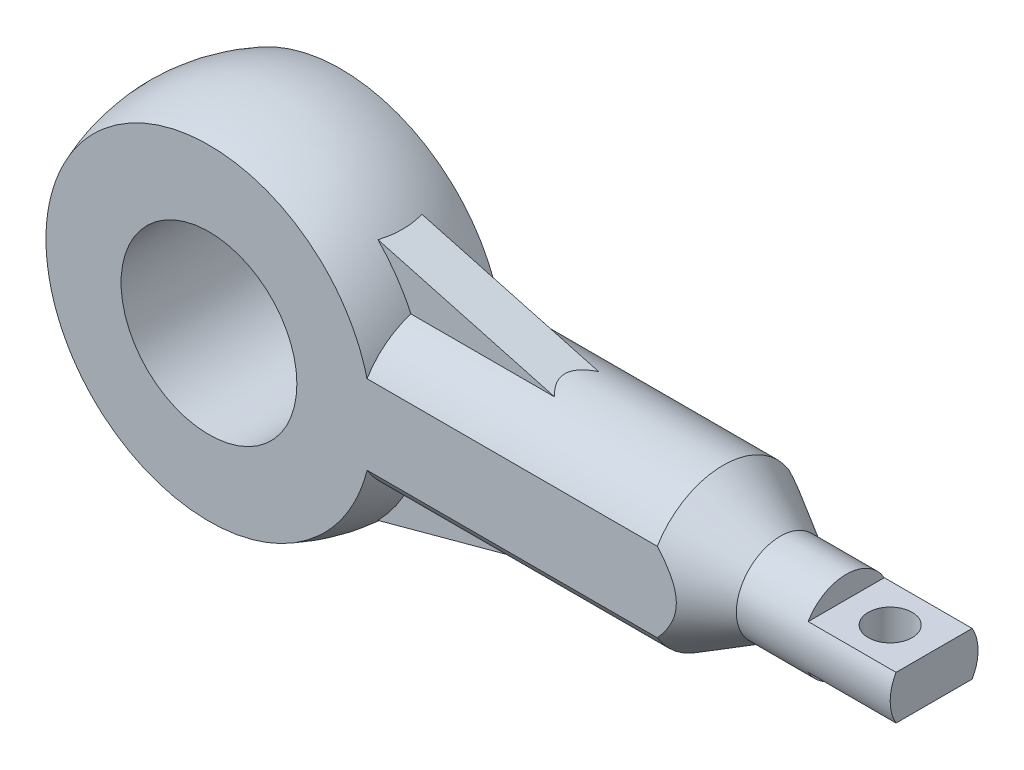
from build123d import *

# Parameters (mm, degrees)
CUT_EXTRUDE_START                    = 15
SKETCH_4_W                           = 227.596726831
SKETCH_4_H                           = 99.432892292
CUT_EXTRUDE_1_DEPTH                  = 50
CUT_EXTRUDE_2_REACH                  = 160.114
SKETCH_5_R                           = 20
CUT_EXTRUDE_4_REACH                  = 157.965
CUT_EXTRUDE_4_END_RADIUS             = 10
SKETCH_6_W                           = 20
SKETCH_6_H                           = 5
CUT_EXTRUDE_4_DIRECTION_2_REACH      = 157.965
CUT_EXTRUDE_4_DIRECTION_2_END_RADIUS = 10
CUT_EXTRUDE_5_REACH                  = 159.321
SKETCH_8_R                           = 5
RIB_1_REACH                          = 157.965
SKETCH_9_WALL_W                      = 352.18110561
SKETCH_9_WALL_H                      = 10


with BuildPart() as part:
    # 草图2 → 旋转1 (revolve)
    with BuildSketch(Plane.XY, mode=Mode.PRIVATE) as revolve_1_sk:
        with BuildLine():
            Line((35.968736425, 17.5), (102.009618943, 17.5))
            Line((102.009618943, 17.5), (115, 10))
            Line((115, 10), (150, 10))
            Line((150, 10), (150, 0))
            Line((150, 0), (40, 0))
            Line((40, 0), (-40, 0))
            ThreePointArc((-40, 0), (-8.979157617, 38.979157617), (35.968736425, 17.5))
        make_face()
    revolve(revolve_1_sk.sketch.rotate(Axis((0, 0, 0), (1, 0, 0)), 90), axis=Axis((0, 0, 0), (1, 0, 0)))

    # 草图4 → 切除-拉伸1 (cut)
    with BuildSketch(Plane.XY.offset(CUT_EXTRUDE_START)):
        with Locations((54.933799673, 2.64801311)):
            Rectangle(SKETCH_4_W, SKETCH_4_H)
    cut_extrude_1 = extrude(amount=CUT_EXTRUDE_1_DEPTH, mode=Mode.SUBTRACT)

    # 镜向1: 切除-拉伸1 across plane
    add(cut_extrude_1.mirror(Plane.XY), mode=Mode.SUBTRACT)

    # 草图5 → 切除-拉伸2 (cut, up to next)
    with BuildSketch(Plane.XY.offset(15), mode=Mode.PRIVATE) as cut_extrude_2_sk1:
        Circle(SKETCH_5_R)
    cut_extrude_2_tool1 = extrude(cut_extrude_2_sk1.sketch, amount=-CUT_EXTRUDE_2_REACH, mode=Mode.PRIVATE) & part.part
    add(cut_extrude_2_tool1.solids().sort_by_distance((0, 0, 15))[0], mode=Mode.SUBTRACT)

    # 切除-拉伸4: up to this cylinder (the profile starts inside it)
    cut_extrude_4_end = Plane(origin=(140, 0, 0), z_dir=(-1, 0, 0)) * Cylinder(CUT_EXTRUDE_4_END_RADIUS, 336.93, mode=Mode.PRIVATE)
    # 草图6 → 切除-拉伸4 (cut, up to the surface)
    with BuildSketch(Plane.XY, mode=Mode.PRIVATE) as cut_extrude_4_sk1:
        with Locations((140, 7.5)):
            Rectangle(SKETCH_6_W, SKETCH_6_H)
    cut_extrude_4_tool1 = extrude(cut_extrude_4_sk1.sketch, amount=-CUT_EXTRUDE_4_REACH, mode=Mode.PRIVATE) & cut_extrude_4_end
    add(cut_extrude_4_tool1.solids().sort_by_distance((140, 7.5, 0))[0], mode=Mode.SUBTRACT)
    # 草图6 → 切除-拉伸4 (cut, up to the surface)
    with BuildSketch(Plane.XY, mode=Mode.PRIVATE) as cut_extrude_4_sk2:
        with Locations((140, -7.5)):
            Rectangle(SKETCH_6_W, SKETCH_6_H)
    cut_extrude_4_tool2 = extrude(cut_extrude_4_sk2.sketch, amount=-CUT_EXTRUDE_4_REACH, mode=Mode.PRIVATE) & cut_extrude_4_end
    add(cut_extrude_4_tool2.solids().sort_by_distance((140, -7.5, 0))[0], mode=Mode.SUBTRACT)

    # 切除-拉伸4 direction 2: up to this cylinder (the profile starts inside it)
    cut_extrude_4_direction_2_end = Plane(origin=(140, 0, 0), z_dir=(-1, 0, 0)) * Cylinder(CUT_EXTRUDE_4_DIRECTION_2_END_RADIUS, 336.93, mode=Mode.PRIVATE)
    # 草图6 → 切除-拉伸4 direction 2 (cut, up to the surface)
    with BuildSketch(Plane.XY, mode=Mode.PRIVATE) as cut_extrude_4_direction_2_sk1:
        with Locations((140, 7.5)):
            Rectangle(SKETCH_6_W, SKETCH_6_H)
    cut_extrude_4_direction_2_tool1 = extrude(cut_extrude_4_direction_2_sk1.sketch, amount=CUT_EXTRUDE_4_DIRECTION_2_REACH, mode=Mode.PRIVATE) & cut_extrude_4_direction_2_end
    add(cut_extrude_4_direction_2_tool1.solids().sort_by_distance((140, 7.5, 0))[0], mode=Mode.SUBTRACT)
    # 草图6 → 切除-拉伸4 direction 2 (cut, up to the surface)
    with BuildSketch(Plane.XY, mode=Mode.PRIVATE) as cut_extrude_4_direction_2_sk2:
        with Locations((140, -7.5)):
            Rectangle(SKETCH_6_W, SKETCH_6_H)
    cut_extrude_4_direction_2_tool2 = extrude(cut_extrude_4_direction_2_sk2.sketch, amount=CUT_EXTRUDE_4_DIRECTION_2_REACH, mode=Mode.PRIVATE) & cut_extrude_4_direction_2_end
    add(cut_extrude_4_direction_2_tool2.solids().sort_by_distance((140, -7.5, 0))[0], mode=Mode.SUBTRACT)

    # 草图8 → 切除-拉伸5 (cut, up to next)
    with BuildSketch(Plane(origin=(0, 5, 0), x_dir=(1, 0, 0), z_dir=(0, 1, 0)), mode=Mode.PRIVATE) as cut_extrude_5_sk1:
        with Locations(Location((140, 0, 0), (0, 0, 270))):
            Circle(SKETCH_8_R)
    cut_extrude_5_tool1 = extrude(cut_extrude_5_sk1.sketch, amount=-CUT_EXTRUDE_5_REACH, mode=Mode.PRIVATE) & part.part
    add(cut_extrude_5_tool1.solids().sort_by_distance((140, 5, 0))[0], mode=Mode.SUBTRACT)

    # 草图9 wall → 筋1 (add, up to next)
    with BuildSketch(Plane(origin=(47.508055761, 22.5, 0), x_dir=(0.965223306875, -0.261426792555, 0), z_dir=(0.261426792555, 0.965223306875, 0)), mode=Mode.PRIVATE) as rib_1_sk1:
        Rectangle(SKETCH_9_WALL_W, SKETCH_9_WALL_H)
    rib_1_tool1 = extrude(rib_1_sk1.sketch, amount=-RIB_1_REACH, mode=Mode.PRIVATE) - part.part
    rib_1 = rib_1_tool1.solids().sort_by_distance((47.508055761, 22.5, 0))[0]
    add(rib_1)

    # 镜向2: 筋1 across plane
    add(rib_1.mirror(Plane(origin=(0, 0, 0), x_dir=(0, 0, 1), z_dir=(0, -1, 0))))


solid = part.part
